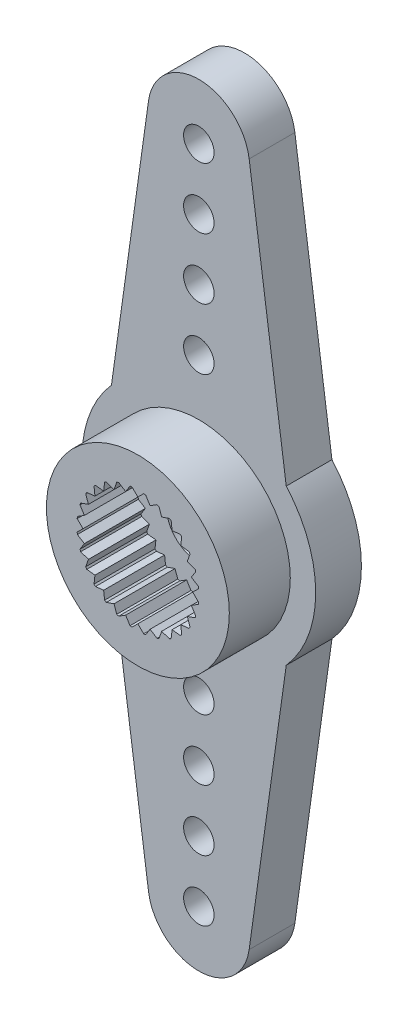
from build123d import *

# Parameters (mm, degrees)
ESQUISSE1_R                  = 5.75
ESQUISSE1_R_2                = 1.6
BOSS_EXTRU_1_DEPTH           = 5.25
ESQUISSE2_R                  = 3
ENL_V_MAT_EXTRU_1_DEPTH      = 3
ENL_V_START                  = -3
ESQUISSE3_R                  = 5.75
ESQUISSE3_R_2                = 4.5
ENL_V_MAT_EXTRU_2_DEPTH      = 3
BOSS_EXTRU_2_DEPTH           = 2.25
R_P_TITION_CIRCULAIRE1_COUNT = 2
ESQUISSE5_R                  = 0.75
ENL_V_MAT_EXTRU_3_DEPTH      = 3
R_P_TITION_CIRCULAIRE2_COUNT = 2
BOSS_EXTRU_3_DEPTH           = 3
R_P_TITION_CIRCULAIRE3_COUNT = 28
ENL_V_START_2                = -1
ESQUISSE7_R                  = 3
ESQUISSE7_R_2                = 1.6
ENL_V_MAT_EXTRU_4_DEPTH      = 1
ESQUISSE8_R                  = 4.7
ESQUISSE8_R_2                = 3.4
ENL_V_MAT_EXTRU_5_DEPTH      = 1


with BuildPart() as part:
    # Esquisse1 → Boss.-Extru.1 (new body)
    with BuildSketch(Plane.XY):
        with Locations(Location((0, 0, 0), (0, 0, 180))):
            Circle(ESQUISSE1_R)
        with Locations(Location((0, 0, 0), (0, 0, 180))):
            Circle(ESQUISSE1_R_2, mode=Mode.SUBTRACT)
    extrude(amount=BOSS_EXTRU_1_DEPTH)

    # Esquisse2 → Enlèv. mat.-Extru.1 (cut)
    with BuildSketch(Plane.XY.offset(5.25)):
        Circle(ESQUISSE2_R)
    extrude(amount=-ENL_V_MAT_EXTRU_1_DEPTH, mode=Mode.SUBTRACT)

    # Esquisse3 → Enlèv. mat.-Extru.2 (cut)
    with BuildSketch(Plane.XY.offset(5.25).offset(ENL_V_START)):
        with Locations(Location((0, 0, 0), (0, 0, 180))):
            Circle(ESQUISSE3_R)
        Circle(ESQUISSE3_R_2, mode=Mode.SUBTRACT)
    extrude(amount=ENL_V_MAT_EXTRU_2_DEPTH, mode=Mode.SUBTRACT)

    # Esquisse4 → Boss.-Extru.2 (add)
    with BuildSketch(Plane(origin=(0, 0, 0), x_dir=(-1, 0, 0), z_dir=(0, 0, -1))):
        with BuildLine():
            Line((-4.3, 3.817394399), (-2.475852955, 16.846629695))
            ThreePointArc((-2.475852955, 16.846629695), (0, 19), (2.475852955, 16.846629695))
            Line((2.475852955, 16.846629695), (4.3, 3.817394399))
            ThreePointArc((4.3, 3.817394399), (0, 5.75), (-4.3, 3.817394399))
        make_face()
    boss_extru_2 = extrude(amount=-BOSS_EXTRU_2_DEPTH)

    # Répétition circulaire1: Boss.-Extru.2 ×2 about axis
    r_p_tition_circulaire1_axis = Axis((0, 0, 0), (0, 0, 1))
    for i in range(1, R_P_TITION_CIRCULAIRE1_COUNT):
        add(boss_extru_2.rotate(r_p_tition_circulaire1_axis, i * 360 / R_P_TITION_CIRCULAIRE1_COUNT))

    # Esquisse5 → Enlèv. mat.-Extru.3 (cut)
    with BuildSketch(Plane(origin=(0, 0, 0), x_dir=(-1, 0, 0), z_dir=(0, 0, -1))):
        with Locations((0, 7.25)):
            Circle(ESQUISSE5_R)
        with Locations((0, 10.25)):
            Circle(ESQUISSE5_R)
        with Locations((0, 13.25)):
            Circle(ESQUISSE5_R)
        with Locations((0, 16.25)):
            Circle(ESQUISSE5_R)
    enl_v_mat_extru_3 = extrude(amount=-ENL_V_MAT_EXTRU_3_DEPTH, mode=Mode.SUBTRACT)

    # Répétition circulaire2: Enlèv. mat.-Extru.3 ×2 about axis
    r_p_tition_circulaire2_axis = Axis((0, 0, 0), (0, 0, 1))
    for i in range(1, R_P_TITION_CIRCULAIRE2_COUNT):
        add(enl_v_mat_extru_3.rotate(r_p_tition_circulaire2_axis, i * 360 / R_P_TITION_CIRCULAIRE2_COUNT), mode=Mode.SUBTRACT)

    # Esquisse6 → Boss.-Extru.3 (add)
    with BuildSketch(Plane.XY.offset(5.25)):
        Polygon((-0.3, 3), (0, 2.7), (0.3, 3), align=None)
    boss_extru_3 = extrude(amount=-BOSS_EXTRU_3_DEPTH)

    # Répétition circulaire3: Boss.-Extru.3 ×28 about axis
    r_p_tition_circulaire3_axis = Axis((0, 0, 0), (0, 0, 1))
    for i in range(1, R_P_TITION_CIRCULAIRE3_COUNT):
        add(boss_extru_3.rotate(r_p_tition_circulaire3_axis, i * 360 / R_P_TITION_CIRCULAIRE3_COUNT))

    # Esquisse7 → Enlèv. mat.-Extru.4 (cut)
    with BuildSketch(Plane(origin=(0, 0, 0), x_dir=(-1, 0, 0), z_dir=(0, 0, -1)).offset(ENL_V_START_2)):
        Circle(ESQUISSE7_R)
        Circle(ESQUISSE7_R_2, mode=Mode.SUBTRACT)
    extrude(amount=ENL_V_MAT_EXTRU_4_DEPTH, mode=Mode.SUBTRACT)

    # Esquisse8 → Enlèv. mat.-Extru.5 (cut)
    with BuildSketch(Plane(origin=(0, 0, 0), x_dir=(-1, 0, 0), z_dir=(0, 0, -1))):
        Circle(ESQUISSE8_R)
        Circle(ESQUISSE8_R_2, mode=Mode.SUBTRACT)
    extrude(amount=-ENL_V_MAT_EXTRU_5_DEPTH, mode=Mode.SUBTRACT)


solid = part.part
